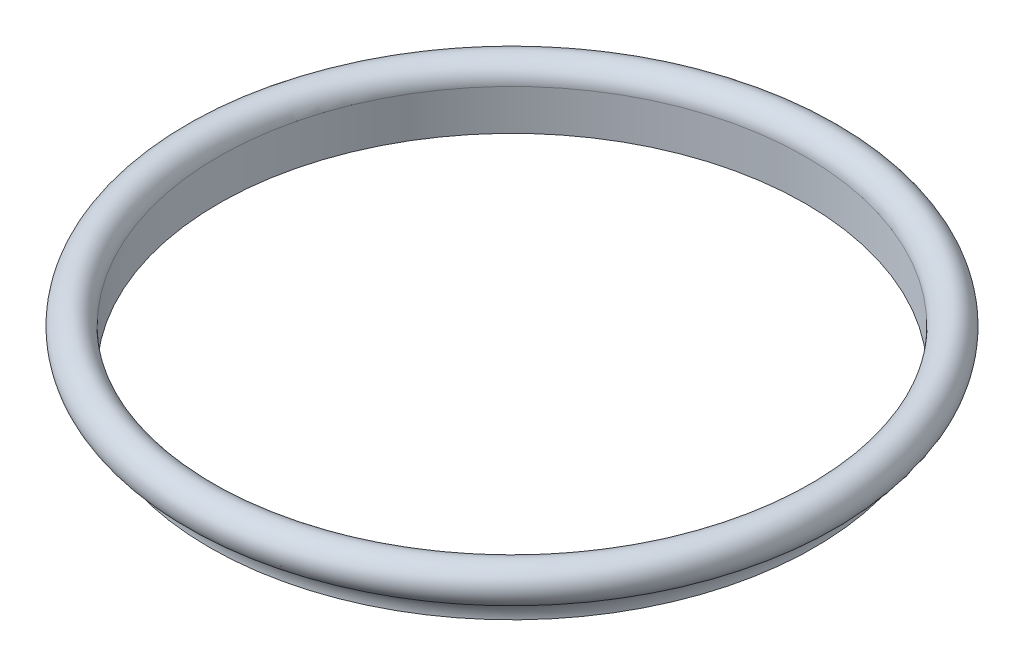
from build123d import *


with BuildPart() as part:
    # Sketch1 → Revolve1 (revolve)
    with BuildSketch(Plane.XY, mode=Mode.PRIVATE) as revolve1_sk:
        with BuildLine():
            Line((82.55, 0), (82.55, 11.43))
            ThreePointArc((82.55, 11.43), (89.876284167, 15.986380959), (90.723467497, 7.400501415))
            ThreePointArc((90.723467497, 7.400501415), (86.495930059, 4.774193712), (85.09, 0))
            Line((85.09, 0), (82.55, 0))
        make_face()
    revolve(revolve1_sk.sketch.rotate(Axis((0, 0, 0), (0, 1, 0)), 90), axis=Axis((0, 0, 0), (0, 1, 0)))


solid = part.part
